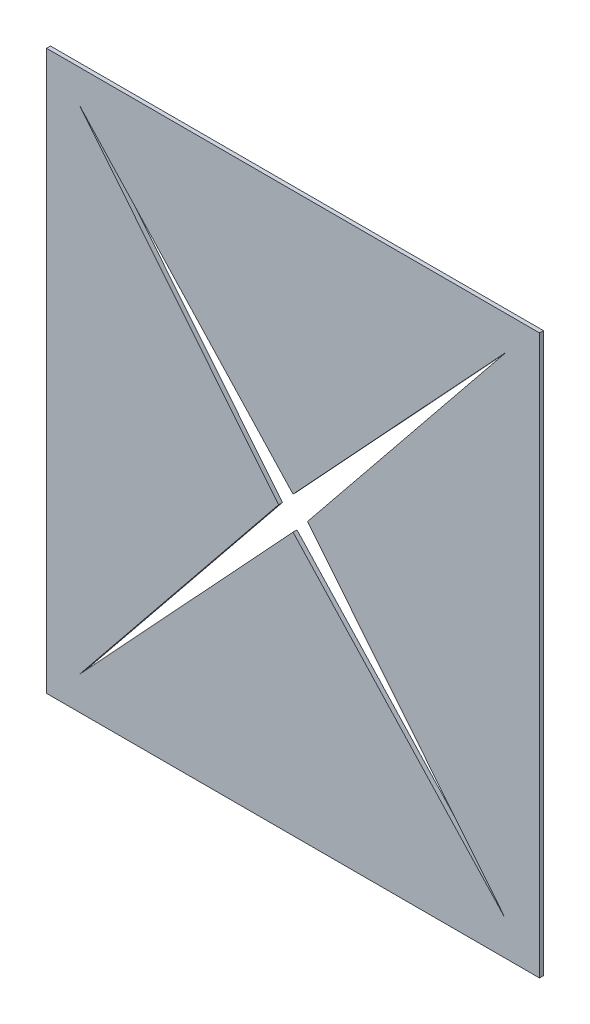
from build123d import *

# Parameters (mm, degrees)
SKETCH1_W           = 95.25
SKETCH1_H           = 107.95
SKETCH1_W_2         = 82.55
SKETCH1_H_2         = 95.25
BOSS_EXTRUDE1_DEPTH = 0.762


with BuildPart() as part:
    # Sketch1 → Boss-Extrude1 (new body)
    # profile 1 of 5: a face of its own
    with BuildSketch(Plane.XY):
        Rectangle(SKETCH1_W, SKETCH1_H)
        Rectangle(SKETCH1_W_2, SKETCH1_H_2, mode=Mode.SUBTRACT)
    # profile 2 of 5: a face of its own
    with BuildSketch(Plane.XY):
        Polygon((-2.801470588, 0), (-41.275, -47.625), (-41.275, 47.625), align=None)
    # profile 3 of 5: a face of its own
    with BuildSketch(Plane.XY):
        Polygon((0, 3.175), (-41.275, 47.625), (41.275, 47.625), align=None)
    # profile 4 of 5: a face of its own
    with BuildSketch(Plane.XY):
        Polygon((2.801470588, 0), (41.275, 47.625), (41.275, -47.625), align=None)
    # profile 5 of 5: a face of its own
    with BuildSketch(Plane.XY):
        Polygon((41.275, -47.625), (0, -3.175), (-41.275, -47.625), align=None)
    extrude(amount=BOSS_EXTRUDE1_DEPTH)


solid = part.part
